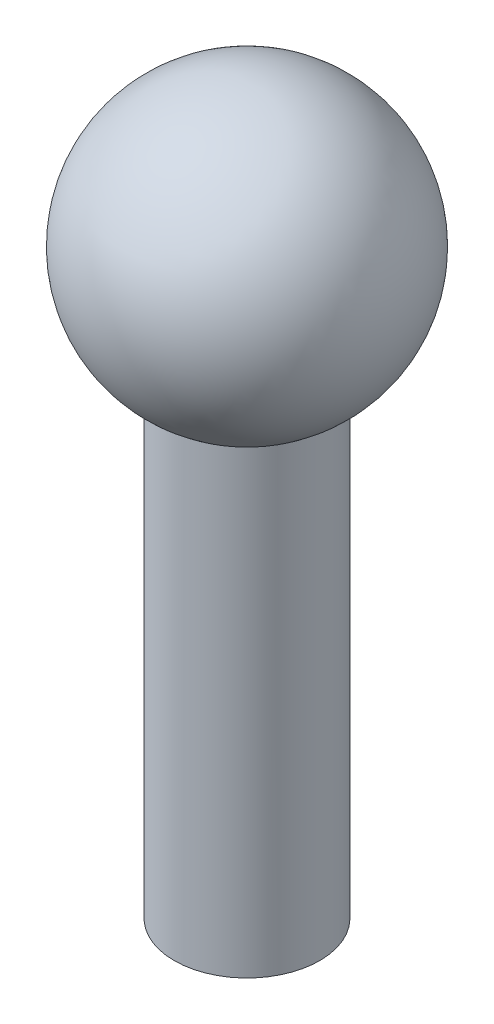
from build123d import *
from build123d.topology import SkipClean


with BuildPart() as part:
    # Sketch2 → Revolve1 (revolve)
    with SkipClean():  # the faces are left unmerged after this step: merging them gives an invalid solid
        with BuildSketch(Plane.XY, mode=Mode.PRIVATE) as revolve1_sk:
            with BuildLine():
                ThreePointArc((-2, 12.651866191), (-1.037371232, 12.24049725), (0, 12.1))
                Line((0, 12.1), (0, 19.9))
                ThreePointArc((0, 19.9), (-3.75950275, 17.037371232), (-2, 12.651866191))
            make_face()
            with BuildLine():
                Line((0, 19.9), (0, 12.1))
                ThreePointArc((0, 12.1), (2.757716447, 13.242283553), (3.9, 16))
                ThreePointArc((3.9, 16), (2.757716447, 18.757716447), (0, 19.9))
            make_face()
            with BuildLine():
                Line((-2, 0), (0, 0))
                Line((0, 0), (0, 12.1))
                ThreePointArc((0, 12.1), (-1.037371232, 12.24049725), (-2, 12.651866191))
                Line((-2, 12.651866191), (-2, 0))
            make_face()
        revolve(revolve1_sk.sketch.rotate(Axis((0, 19.9, 0), (0, -1, 0)), 180), axis=Axis((0, 19.9, 0), (0, -1, 0)))


solid = part.part
